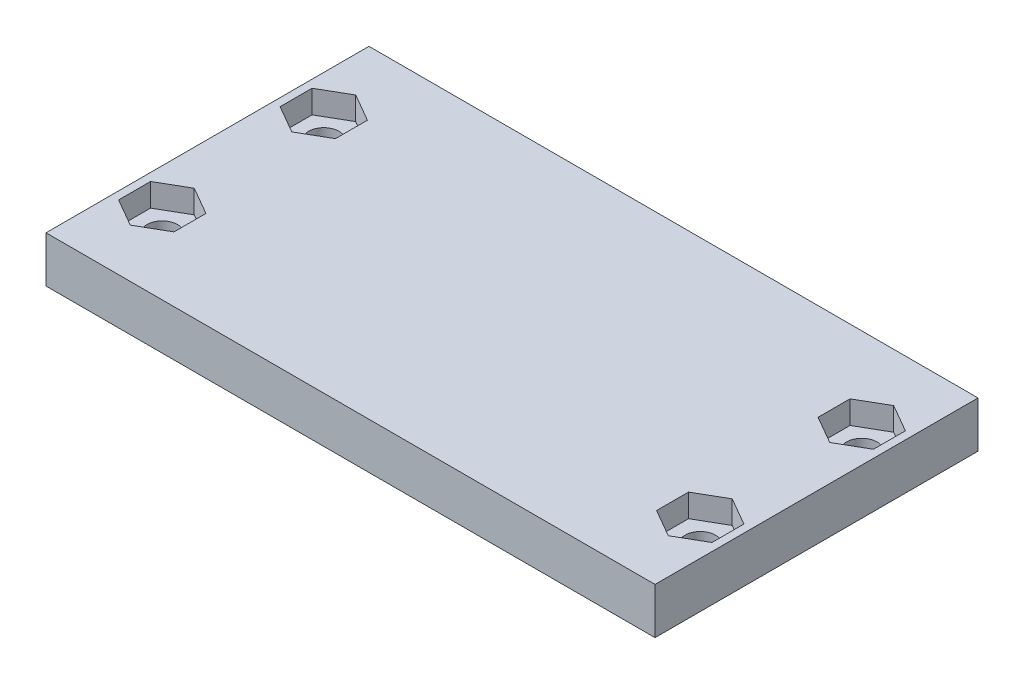
from build123d import *

# Parameters (mm, degrees)
SKETCH1_W           = 66
SKETCH1_H           = 35
BOSS_EXTRUDE1_DEPTH = 5
CUT_EXTRUDE1_DEPTH  = 2.5
SKETCH3_R           = 1.65
CUT_EXTRUDE3_DEPTH  = 75.873226189


with BuildPart() as part:
    # Sketch1 → Boss-Extrude1 (new body)
    with BuildSketch(Plane(origin=(0, 0, 0), x_dir=(1, 0, 0), z_dir=(0, 1, 0))):
        with Locations((33, 17.5)):
            Rectangle(SKETCH1_W, SKETCH1_H)
    extrude(amount=BOSS_EXTRUDE1_DEPTH)

    # Sketch2 → Cut-Extrude1 (cut)
    with BuildSketch(Plane(origin=(0, 5, 0), x_dir=(1, 0, 0), z_dir=(0, 1, 0))):
        Polygon((65.15, 7.017949192), (62.15, 5.285898385), (59.15, 7.017949192), (59.15, 10.482050808), (62.15, 12.214101615), (65.15, 10.482050808), align=None)
        Polygon((3.85, 29.714101615), (0.85, 27.982050808), (0.85, 24.517949192), (3.85, 22.785898385), (6.85, 24.517949192), (6.85, 27.982050808), align=None)
        Polygon((3.85, 5.285898385), (6.85, 7.017949192), (6.85, 10.482050808), (3.85, 12.214101615), (0.85, 10.482050808), (0.85, 7.017949192), align=None)
        Polygon((59.15, 27.982050808), (62.15, 29.714101615), (65.15, 27.982050808), (65.15, 24.517949192), (62.15, 22.785898385), (59.15, 24.517949192), align=None)
    extrude(amount=-CUT_EXTRUDE1_DEPTH, mode=Mode.SUBTRACT)

    # Sketch3 → Cut-Extrude3 (cut, through all)
    with BuildSketch(Plane(origin=(0, 5, 0), x_dir=(1, 0, 0), z_dir=(0, 1, 0))):
        with Locations(Location((3.85, 8.75, 0), (0, 0, 270))):
            Circle(SKETCH3_R)
        with Locations(Location((3.85, 26.25, 0), (0, 0, 270))):
            Circle(SKETCH3_R)
        with Locations(Location((62.15, 26.25, 0), (0, 0, 270))):
            Circle(SKETCH3_R)
        with Locations(Location((62.15, 8.75, 0), (0, 0, 270))):
            Circle(SKETCH3_R)
    extrude(amount=-CUT_EXTRUDE3_DEPTH, mode=Mode.SUBTRACT)


solid = part.part
